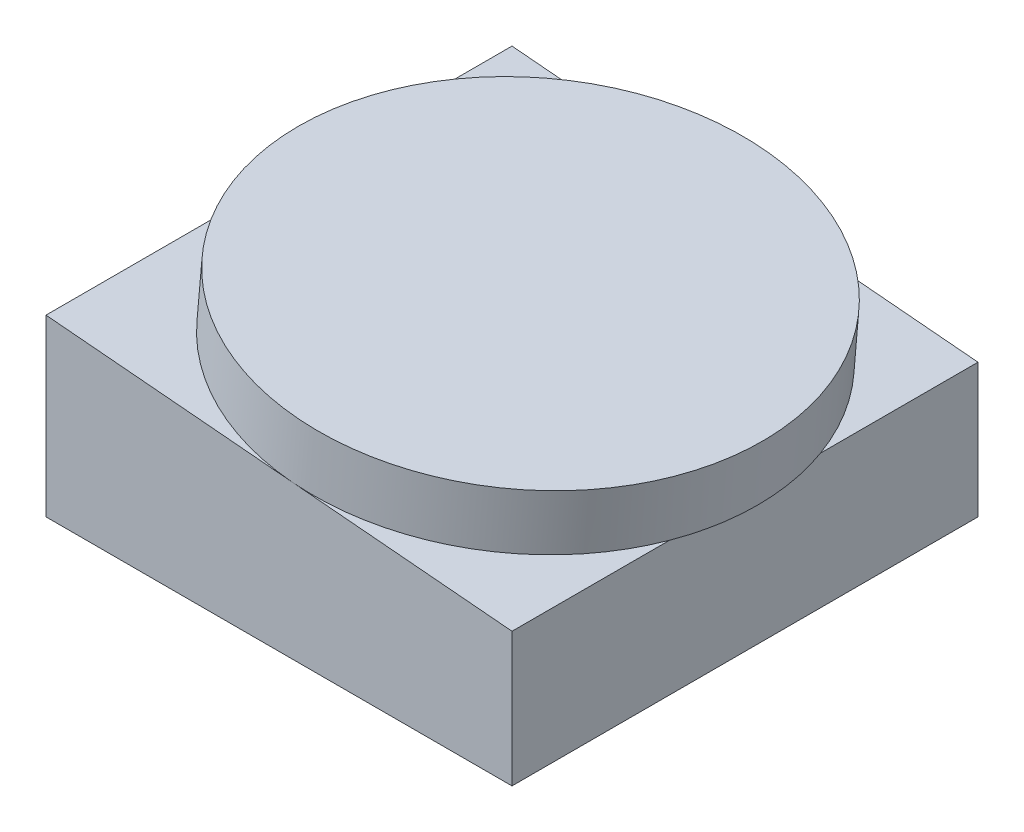
from build123d import *

# Parameters (mm, degrees)
SKETCH3_W           = 40
SKETCH3_H           = 40
BOSS_EXTRUDE3_DEPTH = 15
SKETCH5_W           = 53.617813986
SKETCH5_H           = 48.453012442
CUT_EXTRUDE1_DEPTH  = 6
SKETCH6_R           = 20
BOSS_EXTRUDE4_DEPTH = 5


with BuildPart() as part:
    # Sketch3 → Boss-Extrude3 (new body)
    with BuildSketch(Plane(origin=(0, 0, 0), x_dir=(1, 0, 0), z_dir=(0, 1, 0))):
        Rectangle(SKETCH3_W, SKETCH3_H)
    extrude(amount=BOSS_EXTRUDE3_DEPTH)

    # Sketch5 → Cut-Extrude1 (cut)
    with BuildSketch(Plane(origin=(1.150438863, 13.149576371, 0), x_dir=(0, 0, 1), z_dir=(0.08715574274765836, 0.9961946980917455, 0))):
        Rectangle(SKETCH5_W, SKETCH5_H)
    extrude(amount=CUT_EXTRUDE1_DEPTH, mode=Mode.SUBTRACT)

    # Sketch6 → Boss-Extrude4 (add)
    with BuildSketch(Plane(origin=(1.150438863, 13.149576371, 0), x_dir=(0.9961946980917455, -0.08715574274765835, 0), z_dir=(0.08715574274765836, 0.9961946980917457, 0))):
        with Locations(Location((0, 0, 0), (0, 0, 341.098728442))):
            Circle(SKETCH6_R)
    extrude(amount=BOSS_EXTRUDE4_DEPTH)


solid = part.part
